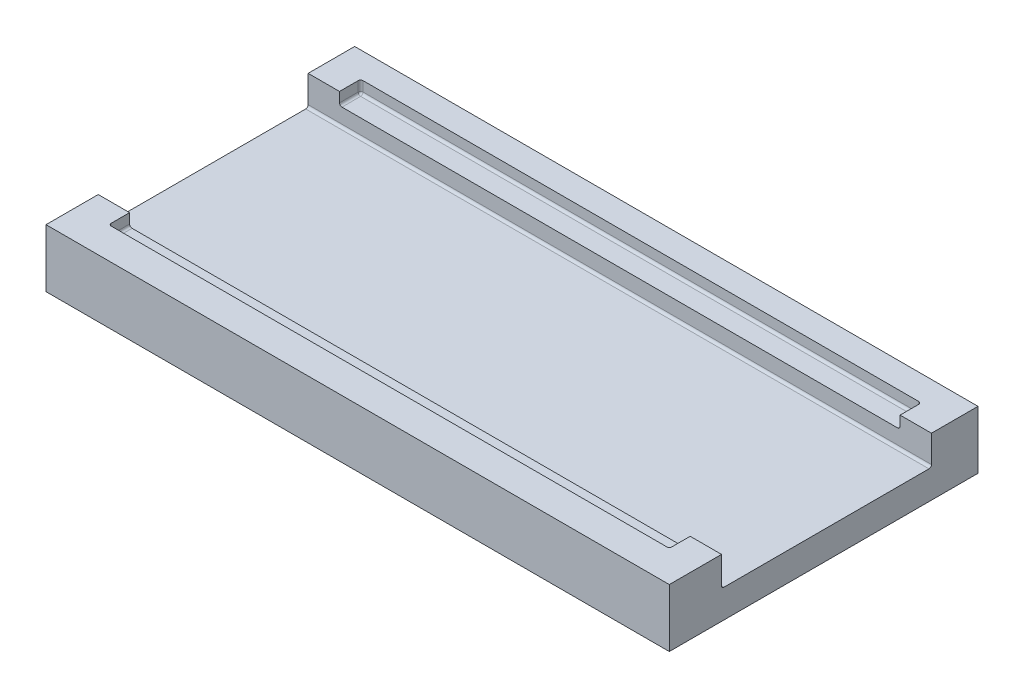
from build123d import *

# Parameters (mm, degrees)
SKETCH1_W           = 252.4
SKETCH1_H           = 125
BOSS_EXTRUDE1_DEPTH = 23.5
SKETCH2_W           = 227
SKETCH2_H           = 102
CUT_EXTRUDE1_DEPTH  = 5
SKETCH3_W           = 227
SKETCH3_H           = 85
CUT_EXTRUDE2_DEPTH  = 7
SKETCH4_W           = 12.7
SKETCH4_H           = 85
CUT_EXTRUDE3_DEPTH  = 12
SKETCH5_W           = 12.7
SKETCH5_H           = 85
CUT_EXTRUDE4_DEPTH  = 12
FILLET1_R           = 1


with BuildPart() as part:
    # Sketch1 → Boss-Extrude1 (new body)
    with BuildSketch(Plane(origin=(0, 0, 0), x_dir=(1, 0, 0), z_dir=(0, 1, 0))):
        with Locations((126.2, 62.5)):
            Rectangle(SKETCH1_W, SKETCH1_H)
    extrude(amount=BOSS_EXTRUDE1_DEPTH)

    # Sketch2 → Cut-Extrude1 (cut)
    with BuildSketch(Plane(origin=(0, 23.5, 0), x_dir=(1, 0, 0), z_dir=(0, 1, 0))):
        with Locations((126.2, 63.7)):
            Rectangle(SKETCH2_W, SKETCH2_H)
    extrude(amount=-CUT_EXTRUDE1_DEPTH, mode=Mode.SUBTRACT)

    # Sketch3 → Cut-Extrude2 (cut)
    with BuildSketch(Plane(origin=(0, 18.5, 0), x_dir=(1, 0, 0), z_dir=(0, 1, 0))):
        with Locations((126.2, 63.65)):
            Rectangle(SKETCH3_W, SKETCH3_H)
    extrude(amount=-CUT_EXTRUDE2_DEPTH, mode=Mode.SUBTRACT)

    # Sketch4 → Cut-Extrude3 (cut)
    with BuildSketch(Plane(origin=(0, 23.5, 0), x_dir=(1, 0, 0), z_dir=(0, 1, 0))):
        with Locations((6.35, 63.65)):
            Rectangle(SKETCH4_W, SKETCH4_H)
    extrude(amount=-CUT_EXTRUDE3_DEPTH, mode=Mode.SUBTRACT)

    # Sketch5 → Cut-Extrude4 (cut)
    with BuildSketch(Plane(origin=(0, 23.5, 0), x_dir=(1, 0, 0), z_dir=(0, 1, 0))):
        with Locations((246.05, 63.65)):
            Rectangle(SKETCH5_W, SKETCH5_H)
    extrude(amount=-CUT_EXTRUDE4_DEPTH, mode=Mode.SUBTRACT)

    # Fillet1
    fillet1_edges = [part.edges().sort_by_distance(p)[0] for p in [
        (12.7, 18.5, -110.425),
        (12.7, 21, -12.7),
        (126.2, 18.5, -114.7),
        (12.7, 21, -114.7),
        (239.7, 18.5, -16.925),
        (239.7, 21, -114.7),
        (126.2, 18.5, -12.7),
        (239.7, 21, -12.7),
        (12.7, 18.5, -16.925),
        (239.7, 18.5, -110.425),
        (126.2, 11.5, -21.15),
        (126.2, 11.5, -106.15),
    ]]
    fillet(fillet1_edges, radius=FILLET1_R)


solid = part.part
